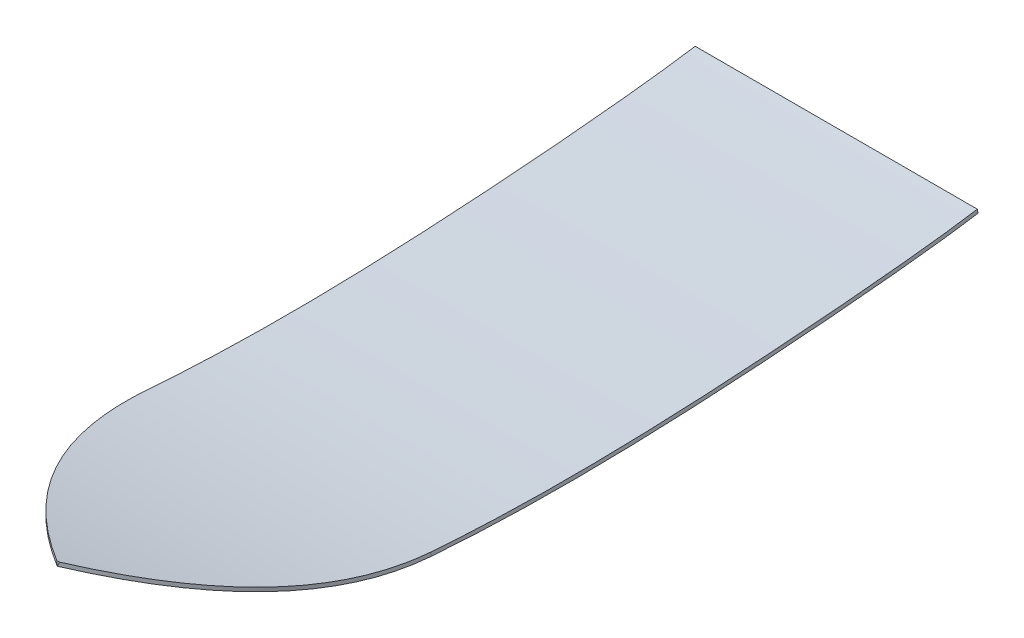
from build123d import *

# Parameters (mm, degrees)
BOSS_EXTRUDE1_DEPTH      = 1524
BOSS_EXTRUDE1_DEPTH_BACK = 1524
CUT_EXTRUDE1_DEPTH       = 2929.337005221
CUT_EXTRUDE1_DEPTH_BACK  = 2929.337005221
SKETCH3_W                = 5731.45735109
SKETCH3_H                = 8003.305882061


with BuildPart() as part:
    # Sketch1 → Boss-Extrude1 (new, two sides: drawn at the far end of the back side and taken through both)
    with BuildSketch(Plane(origin=(0, 0, 0), x_dir=(0, 0, -1), z_dir=(1, 0, 0)).offset(-BOSS_EXTRUDE1_DEPTH_BACK)):
        with BuildLine():
            Line((-2487.091520631, 102.425005316), (-2493.16189924, 78.173190878))
            add(Edge.make_bspline(
                [(-2493.16189924, 78.173190878), (-2482.045802908, 75.390763461), (-2459.790544201, 69.866608608), (-2415.333731452, 59.017544384), (-2359.781612584, 45.809134763), (-2293.133677973, 30.51929111), (-2204.231904037, 10.864408415), (-2092.939861004, -12.355414124), (-1958.817116617, -38.122478322), (-1823.790302423, -61.841524976), (-1642.103835504, -90.795255237), (-1457.231045403, -115.814195327), (-1267.530423659, -136.962490435), (-1122.326393803, -150.890378946), (-973.714217609, -162.865408717), (-822.248711435, -172.792842343), (-667.760431448, -180.664264903), (-457.809192355, -188.395211198), (-187.884771559, -192.880408677), (91.73568052, -190.610289916), (320.916042279, -184.958954677), (495.423261986, -178.882054824), (672.42504038, -171.050912644), (821.880880416, -163.14648546), (942.530688087, -156.049548978), (1063.919506871, -148.454105322), (1217.466377163, -138.019932097), (1401.892505903, -124.20725276), (1583.968461505, -109.305599515), (1761.137389104, -93.520477626), (1902.546351622, -79.802360579), (2010.64650877, -68.593532748), (2088.88692925, -60.095587425), (2163.971886905, -51.532062188), (2235.582151485, -42.928687628), (2292.096852465, -35.747194346), (2335.25432863, -30.007260169), (2366.556116678, -25.707977825), (2396.752449216, -21.417374011), (2420.962945159, -17.851466213), (2439.739479634, -15.006028233), (2453.523306625, -12.875586015), (2464.749955797, -11.10468064), (2473.589075911, -9.688174233), (2477.933541599, -8.98446624), (2480.114703691, -8.629227112)],
                knots=[0.003557981, 0.003557981, 0.003557981, 0.003557981, 0.011342684, 0.019127388, 0.034696794, 0.050266201, 0.065835607, 0.09697442, 0.128113233, 0.159252047, 0.19039086, 0.252668486, 0.283807299, 0.314946112, 0.346084925, 0.377223738, 0.408362551, 0.439501364, 0.501778991, 0.564056617, 0.59519543, 0.626334243, 0.657473056, 0.688611869, 0.704181276, 0.719750682, 0.750889495, 0.782028308, 0.813167121, 0.844305935, 0.875444748, 0.891014154, 0.906583561, 0.922152967, 0.937722374, 0.95329178, 0.961076484, 0.968861187, 0.97664589, 0.984430593, 0.988322945, 0.992215297, 0.996107648, 0.998053824, 1, 1, 1, 1], degree=3))
            Line((2480.114703691, -8.629227112), (2476.095981694, 16.045656343))
            add(Edge.make_bspline(
                [(-2487.091520631, 102.425005316), (-2403.100278601, 81.401479827), (-2258.236636243, 47.437873639), (-2029.443767112, 0.015839863), (-1849.825492955, -32.387554751), (-1684.981322932, -58.573944067), (-1558.666047777, -76.852017897), (-1418.889605336, -94.83344841), (-1276.710724527, -110.87050249), (-1131.63936961, -124.966397441), (-983.116187153, -137.107648184), (-831.691617221, -147.197104329), (-677.22307625, -155.222414149), (-519.743219578, -161.165163293), (-359.232239528, -165.029095532), (-195.732584637, -166.827447657), (-29.284569907, -166.591365766), (168.256206429, -163.9945448), (341.055856615, -159.355939165), (516.460657657, -152.903460511), (664.215924802, -146.421365209), (827.066973089, -137.858855509), (932.994078218, -131.565161362), (993.812763044, -127.782238932), (1071.894257193, -122.844448979), (1210.409610161, -113.461146725), (1395.356246599, -99.643698924), (1577.993493776, -84.725929602), (1814.980561839, -63.646164933), (2147.942872955, -29.981212379), (2372.328491788, -0.854633988), (2476.095981694, 16.045656343)],
                knots=[0.003557981, 0.003557981, 0.003557981, 0.003557981, 0.0625, 0.10546875, 0.1640625, 0.1875, 0.21875, 0.25, 0.28125, 0.3125, 0.34375, 0.375, 0.40625, 0.4375, 0.46875, 0.5, 0.53125, 0.5625, 0.609375, 0.625, 0.65625, 0.6875, 0.709960938, 0.7109375, 0.71875, 0.75, 0.78125, 0.8125, 0.84375, 0.90625, 1, 1, 1, 1], degree=3))
        make_face()
    extrude(amount=BOSS_EXTRUDE1_DEPTH + BOSS_EXTRUDE1_DEPTH_BACK)

    # Sketch3 → Cut-Extrude1 (cut, two sides: drawn at the far end of the back side and taken through both)
    with BuildSketch(Plane(origin=(0, 0, 0), x_dir=(1, 0, 0), z_dir=(0, 1, 0)).offset(-CUT_EXTRUDE1_DEPTH_BACK)):
        with Locations((-68.47307406, 1370.374733043)):
            Rectangle(SKETCH3_W, SKETCH3_H)
        with BuildLine():
            Line((-900, 2508.197393423), (900, 2508.197393423))
            Line((900, 2508.197393423), (900, -1009.33625713))
            add(Edge.make_bspline(
                [(900, -1009.33625713), (900, -1883.974862313), (0, -2493.16189924)],
                knots=[0, 0, 0, 1, 1, 1], degree=2))
            add(Edge.make_bspline(
                [(-900, -1009.33625713), (-900, -1883.974862313), (0, -2493.16189924)],
                knots=[0, 0, 0, 1, 1, 1], degree=2))
            Line((-900, -1009.33625713), (-900, 2508.197393423))
        make_face(mode=Mode.SUBTRACT)
    extrude(amount=CUT_EXTRUDE1_DEPTH + CUT_EXTRUDE1_DEPTH_BACK, mode=Mode.SUBTRACT)


solid = part.part
